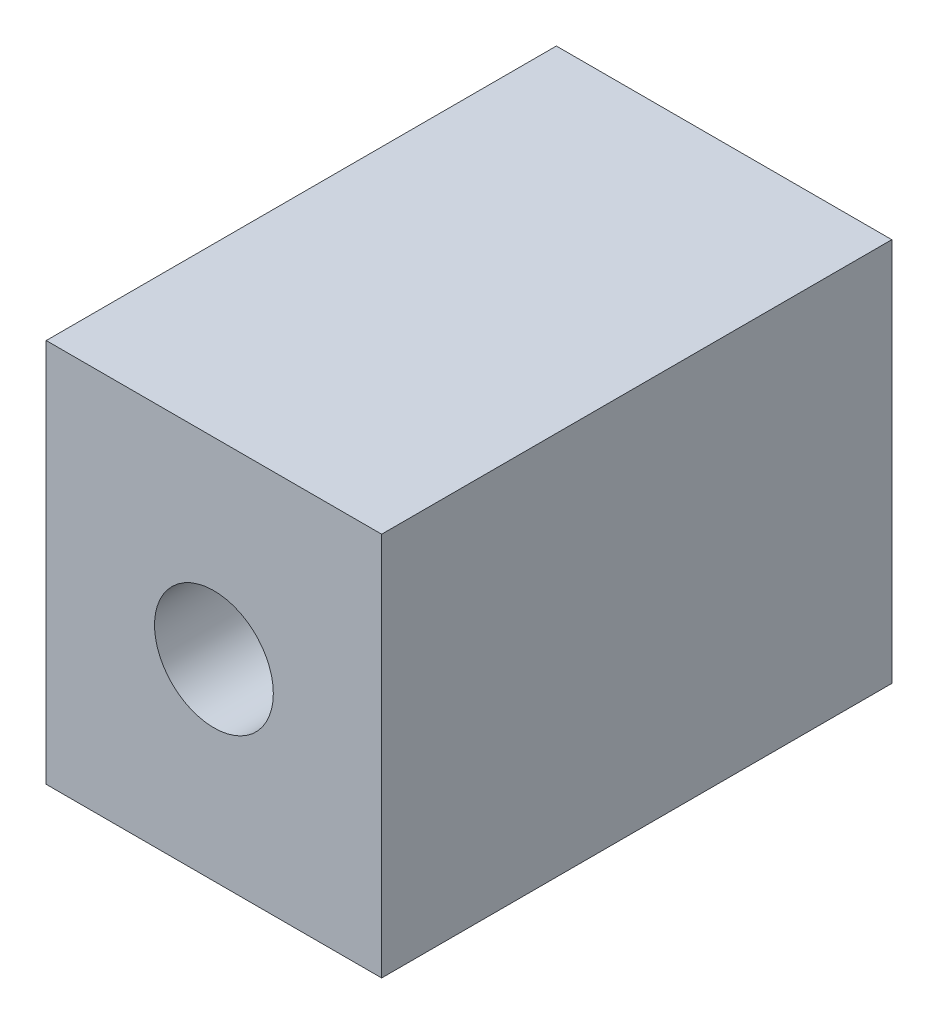
from build123d import *

# Parameters (mm, degrees)
SKETCH_1_W      = 48
SKETCH_1_H      = 55
SKETCH_1_R      = 8.5
EXTRUDE_1_DEPTH = 73
SCALE_1_SCALE   = 0.3


with BuildPart() as part:
    # 草图1 → 凸台-拉伸1 (new body)
    with BuildSketch(Plane.XY):
        Rectangle(SKETCH_1_W, SKETCH_1_H)
        Circle(SKETCH_1_R, mode=Mode.SUBTRACT)
    extrude(amount=EXTRUDE_1_DEPTH)


with BuildPart() as part_1:
    # 缩放比例1: scaled about (0, 0, 0)
    add(part.part.scale(SCALE_1_SCALE))


solid = part_1.part
